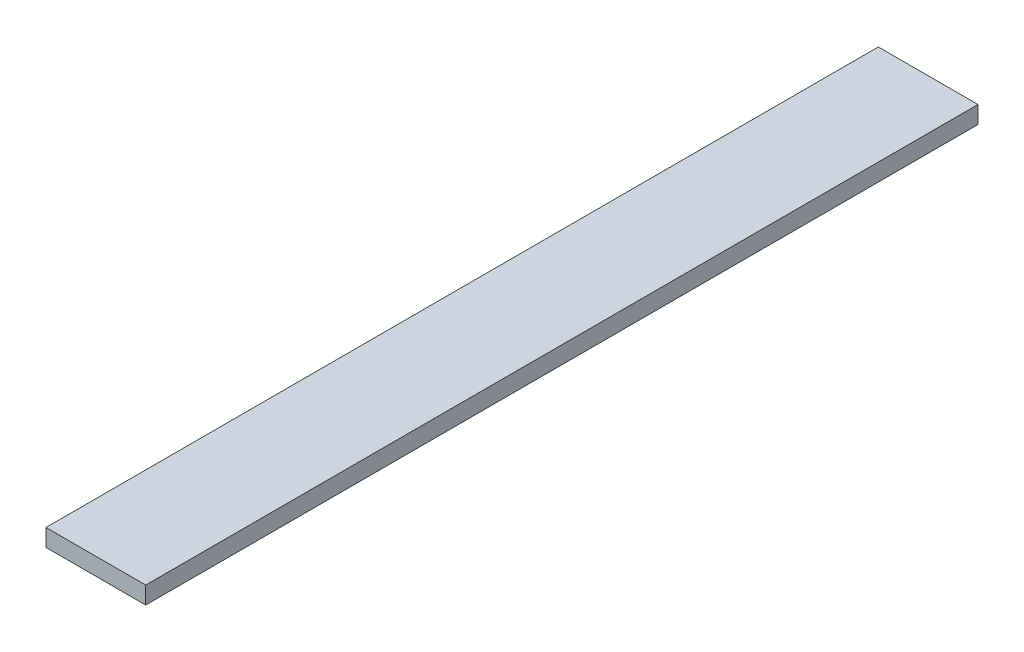
from build123d import *

# Parameters (mm, degrees)
SKETCH1_W           = 115
SKETCH1_H           = 20
BOSS_EXTRUDE1_DEPTH = 960


with BuildPart() as part:
    # Sketch1 → Boss-Extrude1 (new body)
    with BuildSketch(Plane.XY):
        Rectangle(SKETCH1_W, SKETCH1_H)
    extrude(amount=BOSS_EXTRUDE1_DEPTH)


solid = part.part
